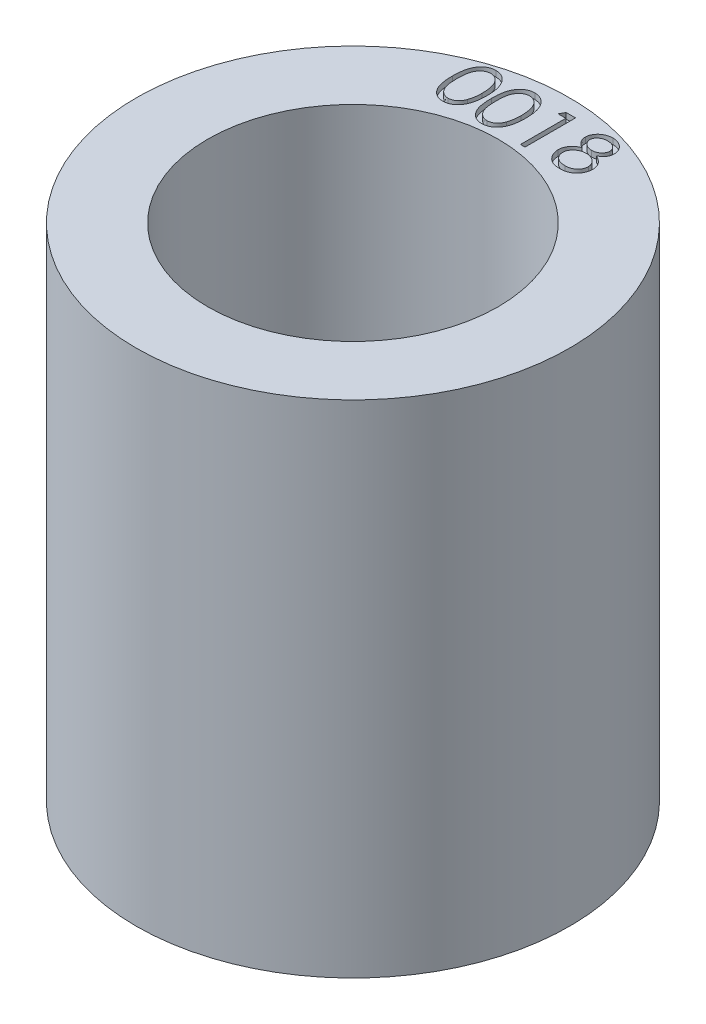
from build123d import *

# Parameters (mm, degrees)
SKETCH1_R           = 3.81
SKETCH1_R_2         = 2.5527
BOSS_EXTRUDE2_DEPTH = 8.8011
CUT_EXTRUDE1_DEPTH  = 0.1016


with BuildPart() as part:
    # Sketch1 → Boss-Extrude2 (new body)
    with BuildSketch(Plane(origin=(0, 0, 0), x_dir=(1, 0, 0), z_dir=(0, 1, 0))):
        with Locations(Location((0, 0, 0), (0, 0, 270))):
            Circle(SKETCH1_R)
        with Locations(Location((0, 0, 0), (0, 0, 270))):
            Circle(SKETCH1_R_2, mode=Mode.SUBTRACT)
    extrude(amount=BOSS_EXTRUDE2_DEPTH)

    # Sketch2 → Cut-Extrude1 (cut)
    # profile 1 of 4: a face of its own
    with BuildSketch(Plane(origin=(0, 8.8011, 0), x_dir=(1, 0, 0), z_dir=(0, 1, 0))):
        with BuildLine():
            add(Edge.make_bspline(
                [(-1.363580857, 3.11114383), (-1.363497541, 3.125392567), (-1.363335697, 3.153070943), (-1.361535238, 3.193402242), (-1.358544301, 3.231238155), (-1.354445408, 3.266580494), (-1.349457361, 3.299438382), (-1.342798628, 3.32972401), (-1.335226176, 3.35757755), (-1.326449855, 3.383089831), (-1.316546956, 3.406604567), (-1.305768654, 3.428556568), (-1.293687196, 3.448912619), (-1.28099306, 3.467997618), (-1.267172394, 3.485499157), (-1.252618501, 3.501664393), (-1.236763345, 3.516119723), (-1.220145901, 3.529288684), (-1.202615719, 3.54083285), (-1.184672481, 3.551001166), (-1.166192685, 3.559687932), (-1.147125874, 3.566518103), (-1.127643424, 3.572159658), (-1.107677229, 3.57601765), (-1.087194323, 3.578445105), (-1.073368739, 3.578677177), (-1.066357099, 3.578794872)],
                knots=[0, 0, 0, 0, 1.646270934, 3.197905019, 4.663502075, 6.030701355, 7.308322542, 8.50163776, 9.611534131, 10.641858119, 11.616356847, 12.558055219, 13.465016945, 14.349605745, 15.204443733, 16.039544428, 16.859896111, 17.680448484, 18.487036065, 19.28249412, 20.06191084, 20.843045899, 21.620316918, 22.403196591, 23.190181807, 24, 24, 24, 24], degree=3))
            add(Edge.make_bspline(
                [(-1.066357099, 3.578794872), (-1.059286888, 3.578670967), (-1.045226461, 3.578424559), (-1.024439006, 3.576056277), (-1.004131787, 3.572126612), (-0.98439138, 3.566558684), (-0.965055633, 3.559650982), (-0.946275786, 3.550992855), (-0.927935187, 3.540914422), (-0.910325294, 3.529071958), (-0.893252781, 3.515868459), (-0.877136999, 3.500942742), (-0.861976479, 3.484445513), (-0.847580951, 3.466553279), (-0.83435883, 3.446922868), (-0.821767178, 3.425895704), (-0.810496681, 3.403104064), (-0.799642073, 3.378928226), (-0.790272779, 3.352699256), (-0.781823152, 3.324565007), (-0.774995894, 3.294193164), (-0.769309019, 3.261743077), (-0.764903416, 3.227095576), (-0.761694725, 3.190324932), (-0.759999761, 3.151406953), (-0.759680559, 3.124798459), (-0.759516755, 3.11114383)],
                knots=[0, 0, 0, 0, 0.810914788, 1.612654377, 2.396697861, 3.181598691, 3.963628158, 4.749916497, 5.551656086, 6.361998678, 7.18212741, 8.025565596, 8.878627764, 9.750805457, 10.657531673, 11.591944965, 12.560506719, 13.57287815, 14.630710178, 15.753379473, 16.941251878, 18.199788006, 19.531962791, 20.947069417, 22.433333509, 24, 24, 24, 24], degree=3))
            add(Edge.make_bspline(
                [(-0.759516755, 3.11114383), (-0.759682257, 3.097548758), (-0.760004732, 3.071059313), (-0.761675723, 3.032316445), (-0.764967216, 2.995740942), (-0.769084553, 2.961245085), (-0.774787097, 2.92897245), (-0.78179881, 2.89881136), (-0.789583992, 2.870631565), (-0.799194029, 2.844663923), (-0.80971235, 2.820546186), (-0.82115637, 2.79802473), (-0.833416905, 2.776900492), (-0.846774447, 2.757342556), (-0.861012014, 2.739212377), (-0.876434332, 2.722829981), (-0.892606661, 2.70780063), (-0.909729414, 2.694427117), (-0.927613948, 2.682721576), (-0.945891554, 2.672253258), (-0.964886533, 2.663812154), (-0.984168423, 2.656564254), (-1.004013028, 2.651026939), (-1.024395611, 2.647198179), (-1.045212495, 2.64451293), (-1.059284493, 2.644308084), (-1.066357099, 2.644205128)],
                knots=[0, 0, 0, 0, 1.561518951, 3.042555995, 4.452378317, 5.7783523, 7.031515105, 8.214008947, 9.334062868, 10.386615937, 11.391082383, 12.354592575, 13.286541444, 14.194233754, 15.072674879, 15.931287219, 16.775624067, 17.606195743, 18.42308326, 19.229000347, 20.022332153, 20.807536673, 21.593273796, 22.3848459, 23.188221202, 24, 24, 24, 24], degree=3))
            add(Edge.make_bspline(
                [(-1.066357099, 2.644205128), (-1.073368544, 2.644323582), (-1.087193745, 2.644557151), (-1.107679461, 2.646973639), (-1.127563202, 2.650858697), (-1.146943085, 2.656298514), (-1.16591854, 2.662957083), (-1.184230997, 2.671632118), (-1.202084069, 2.681622972), (-1.219430124, 2.693001009), (-1.235943213, 2.706036716), (-1.251716258, 2.720454846), (-1.266353013, 2.736615192), (-1.279976074, 2.754262585), (-1.292923492, 2.773234668), (-1.304833393, 2.793790475), (-1.31584959, 2.815848498), (-1.325919036, 2.839551247), (-1.334846797, 2.865244599), (-1.342732915, 2.89322249), (-1.348959511, 2.923731862), (-1.354289181, 2.956527673), (-1.358587975, 2.991750852), (-1.361522773, 3.029420519), (-1.363336667, 3.069513202), (-1.363497975, 3.097013725), (-1.363580857, 3.11114383)],
                knots=[0, 0, 0, 0, 0.810891512, 1.598919785, 2.382837074, 3.152667961, 3.926044502, 4.706494248, 5.493654104, 6.291793342, 7.103789334, 7.925228297, 8.761435821, 9.622817696, 10.50288917, 11.416980706, 12.369136599, 13.353924996, 14.394355917, 15.514179734, 16.714354668, 17.994756427, 19.357759367, 20.818452758, 22.365282078, 24, 24, 24, 24], degree=3))
        make_face()
        with BuildLine():
            add(Edge.make_bspline(
                [(-1.283798806, 3.1115), (-1.283768466, 3.099625831), (-1.283709583, 3.076580399), (-1.282171308, 3.043092211), (-1.280075749, 3.011857747), (-1.27737286, 2.982837349), (-1.273358911, 2.956129246), (-1.268861387, 2.931549746), (-1.263388172, 2.909228928), (-1.256912438, 2.889013624), (-1.249536507, 2.870560761), (-1.241483218, 2.853390052), (-1.232831794, 2.83729866), (-1.22314953, 2.822431124), (-1.212604704, 2.808738958), (-1.201435496, 2.795979819), (-1.189225059, 2.784601385), (-1.172333109, 2.770954764), (-1.150032804, 2.756852904), (-1.121935209, 2.744572998), (-1.093063422, 2.736855854), (-1.073467005, 2.73587446), (-1.063685825, 2.735384615)],
                knots=[0, 0, 0, 0, 1.459021318, 2.831673884, 4.118529203, 5.306027144, 6.411944654, 7.436330062, 8.375795394, 9.233974572, 10.042671642, 10.816086306, 11.563610507, 12.285937304, 12.993564865, 13.685989202, 14.367179055, 15.041617293, 16.353048772, 17.594441528, 18.799311195, 20, 20, 20, 20], degree=3))
            add(Edge.make_bspline(
                [(-1.063685825, 2.735384615), (-1.053841377, 2.735790452), (-1.034172804, 2.736601286), (-1.00543682, 2.744424166), (-0.977539932, 2.756227429), (-0.955677659, 2.770184095), (-0.939045093, 2.783475491), (-0.927128177, 2.794807612), (-0.916190417, 2.807496402), (-0.90581653, 2.821186823), (-0.896301925, 2.836140434), (-0.887649888, 2.852285328), (-0.879754718, 2.869666339), (-0.87525662, 2.881799853), (-0.872956859, 2.888003405)],
                knots=[0, 0, 0, 0, 1.353760809, 2.704726607, 4.075137775, 5.516104923, 6.260822281, 7.007110065, 7.778089737, 8.566572457, 9.372053459, 10.217411131, 11.088608312, 12, 12, 12, 12], degree=3))
            add(Edge.make_bspline(
                [(-0.872956859, 2.888003405), (-0.87027671, 2.895935759), (-0.864834858, 2.912041839), (-0.857821467, 2.937026207), (-0.852298136, 2.963239709), (-0.847329041, 2.990525689), (-0.843937365, 3.019085373), (-0.84120742, 3.048830394), (-0.839599426, 3.07978318), (-0.839400099, 3.100813108), (-0.839298806, 3.1115)],
                knots=[0, 0, 0, 0, 0.884706709, 1.796334032, 2.740027952, 3.714592787, 4.726048262, 5.777819803, 6.87074269, 8, 8, 8, 8], degree=3))
            add(Edge.make_bspline(
                [(-0.839298806, 3.1115), (-0.839438554, 3.122185163), (-0.839711931, 3.143087627), (-0.840756884, 3.173699245), (-0.843455272, 3.202774056), (-0.846452248, 3.230437316), (-0.850871142, 3.256535893), (-0.855635625, 3.281288271), (-0.862036733, 3.304387799), (-0.868874356, 3.326196133), (-0.876700196, 3.346465499), (-0.885314793, 3.365290401), (-0.89451512, 3.382761721), (-0.904508049, 3.398831524), (-0.915174952, 3.41357179), (-0.92679737, 3.426686977), (-0.93891428, 3.438583567), (-0.955885846, 3.45216306), (-0.978104315, 3.46600903), (-1.00575111, 3.478751133), (-1.034521853, 3.48606844), (-1.053971511, 3.487100108), (-1.063685825, 3.487615385)],
                knots=[0, 0, 0, 0, 1.31362396, 2.569729283, 3.763502607, 4.902122613, 5.988968491, 7.01645872, 7.998833611, 8.933434873, 9.825090667, 10.667526885, 11.477055099, 12.250526234, 12.991942729, 13.710640831, 14.402115721, 15.076753259, 16.378508321, 17.609869233, 18.806226677, 20, 20, 20, 20], degree=3))
            add(Edge.make_bspline(
                [(-1.063685825, 3.487615385), (-1.073518315, 3.487099397), (-1.093201209, 3.486066482), (-1.122270989, 3.478778396), (-1.150135895, 3.466075103), (-1.17229561, 3.4521172), (-1.189279012, 3.438823269), (-1.201238016, 3.427295109), (-1.212451144, 3.414684961), (-1.22278074, 3.400866874), (-1.232455418, 3.386016671), (-1.241340595, 3.370017525), (-1.249345996, 3.352788358), (-1.256733469, 3.334343784), (-1.263228957, 3.314130224), (-1.268586823, 3.2918369), (-1.273536535, 3.267335579), (-1.277040533, 3.240482824), (-1.280155527, 3.211455157), (-1.28215739, 3.180142718), (-1.283714729, 3.146598366), (-1.283770219, 3.123433779), (-1.283798806, 3.1115)],
                knots=[0, 0, 0, 0, 1.207732386, 2.417664972, 3.655092373, 4.956220595, 5.625982001, 6.301752483, 6.994047911, 7.697131622, 8.419323945, 9.170223765, 9.943494443, 10.752040957, 11.610060368, 12.549350801, 13.567764191, 14.679664412, 15.874934091, 17.154273443, 18.533957287, 20, 20, 20, 20], degree=3))
        make_face(mode=Mode.SUBTRACT)
    # profile 2 of 4: a face of its own
    with BuildSketch(Plane(origin=(0, 8.8011, 0), x_dir=(1, 0, 0), z_dir=(0, 1, 0))):
        with BuildLine():
            add(Edge.make_bspline(
                [(-0.679734703, 3.11114383), (-0.679651387, 3.125392567), (-0.679489543, 3.153070943), (-0.677689084, 3.193402242), (-0.674698147, 3.231238155), (-0.670599254, 3.266580494), (-0.665611207, 3.299438382), (-0.658952474, 3.32972401), (-0.651380022, 3.35757755), (-0.642603701, 3.383089831), (-0.632700802, 3.406604567), (-0.6219225, 3.428556568), (-0.609841042, 3.448912619), (-0.597146906, 3.467997618), (-0.58332624, 3.485499157), (-0.568772347, 3.501664393), (-0.552917191, 3.516119723), (-0.536299747, 3.529288684), (-0.518769565, 3.54083285), (-0.500826328, 3.551001166), (-0.482346531, 3.559687932), (-0.46327972, 3.566518103), (-0.443797271, 3.572159658), (-0.423831076, 3.57601765), (-0.403348169, 3.578445105), (-0.389522585, 3.578677177), (-0.382510945, 3.578794872)],
                knots=[0, 0, 0, 0, 1.646270934, 3.197905019, 4.663502075, 6.030701355, 7.308322542, 8.50163776, 9.611534131, 10.641858119, 11.616356847, 12.558055219, 13.465016945, 14.349605745, 15.204443733, 16.039544428, 16.859896111, 17.680448484, 18.487036065, 19.28249412, 20.06191084, 20.843045899, 21.620316918, 22.403196591, 23.190181807, 24, 24, 24, 24], degree=3))
            add(Edge.make_bspline(
                [(-0.382510945, 3.578794872), (-0.375440734, 3.578670967), (-0.361380308, 3.578424559), (-0.340592852, 3.576056277), (-0.320285633, 3.572126612), (-0.300545226, 3.566558684), (-0.281209479, 3.559650982), (-0.262429632, 3.550992855), (-0.244089033, 3.540914422), (-0.22647914, 3.529071958), (-0.209406628, 3.515868459), (-0.193290845, 3.500942742), (-0.178130325, 3.484445513), (-0.163734798, 3.466553279), (-0.150512676, 3.446922868), (-0.137921024, 3.425895704), (-0.126650527, 3.403104064), (-0.11579592, 3.378928226), (-0.106426625, 3.352699256), (-0.097976999, 3.324565007), (-0.091149741, 3.294193164), (-0.085462865, 3.261743077), (-0.081057262, 3.227095576), (-0.077848571, 3.190324932), (-0.076153607, 3.151406953), (-0.075834405, 3.124798459), (-0.075670601, 3.11114383)],
                knots=[0, 0, 0, 0, 0.810914788, 1.612654377, 2.396697861, 3.181598691, 3.963628158, 4.749916497, 5.551656086, 6.361998678, 7.18212741, 8.025565596, 8.878627764, 9.750805457, 10.657531673, 11.591944965, 12.560506719, 13.57287815, 14.630710178, 15.753379473, 16.941251878, 18.199788006, 19.531962791, 20.947069417, 22.433333509, 24, 24, 24, 24], degree=3))
            add(Edge.make_bspline(
                [(-0.075670601, 3.11114383), (-0.075836103, 3.097548758), (-0.076158578, 3.071059313), (-0.07782957, 3.032316445), (-0.081121062, 2.995740942), (-0.085238399, 2.961245085), (-0.090940944, 2.92897245), (-0.097952656, 2.89881136), (-0.105737838, 2.870631565), (-0.115347875, 2.844663923), (-0.125866196, 2.820546186), (-0.137310216, 2.79802473), (-0.149570752, 2.776900492), (-0.162928293, 2.757342556), (-0.17716586, 2.739212377), (-0.192588178, 2.722829981), (-0.208760507, 2.70780063), (-0.22588326, 2.694427117), (-0.243767794, 2.682721576), (-0.2620454, 2.672253258), (-0.281040379, 2.663812154), (-0.300322269, 2.656564254), (-0.320166874, 2.651026939), (-0.340549457, 2.647198179), (-0.361366341, 2.64451293), (-0.375438339, 2.644308084), (-0.382510945, 2.644205128)],
                knots=[0, 0, 0, 0, 1.561518951, 3.042555995, 4.452378317, 5.7783523, 7.031515105, 8.214008947, 9.334062868, 10.386615937, 11.391082383, 12.354592575, 13.286541444, 14.194233754, 15.072674879, 15.931287219, 16.775624067, 17.606195743, 18.42308326, 19.229000347, 20.022332153, 20.807536673, 21.593273796, 22.3848459, 23.188221202, 24, 24, 24, 24], degree=3))
            add(Edge.make_bspline(
                [(-0.382510945, 2.644205128), (-0.38952239, 2.644323582), (-0.403347591, 2.644557151), (-0.423833307, 2.646973639), (-0.443717048, 2.650858697), (-0.463096931, 2.656298514), (-0.482072386, 2.662957083), (-0.500384843, 2.671632118), (-0.518237915, 2.681622972), (-0.53558397, 2.693001009), (-0.552097059, 2.706036716), (-0.567870105, 2.720454846), (-0.582506859, 2.736615192), (-0.59612992, 2.754262585), (-0.609077338, 2.773234668), (-0.620987239, 2.793790475), (-0.632003436, 2.815848498), (-0.642072882, 2.839551247), (-0.651000643, 2.865244599), (-0.658886761, 2.89322249), (-0.665113357, 2.923731862), (-0.670443028, 2.956527673), (-0.674741821, 2.991750852), (-0.677676619, 3.029420519), (-0.679490513, 3.069513202), (-0.679651821, 3.097013725), (-0.679734703, 3.11114383)],
                knots=[0, 0, 0, 0, 0.810891512, 1.598919785, 2.382837074, 3.152667961, 3.926044502, 4.706494248, 5.493654104, 6.291793342, 7.103789334, 7.925228297, 8.761435821, 9.622817696, 10.50288917, 11.416980706, 12.369136599, 13.353924996, 14.394355917, 15.514179734, 16.714354668, 17.994756427, 19.357759367, 20.818452758, 22.365282078, 24, 24, 24, 24], degree=3))
        make_face()
        with BuildLine():
            add(Edge.make_bspline(
                [(-0.599952652, 3.1115), (-0.599922312, 3.099625831), (-0.599863429, 3.076580399), (-0.598325154, 3.043092211), (-0.596229595, 3.011857747), (-0.593526706, 2.982837349), (-0.589512757, 2.956129246), (-0.585015233, 2.931549746), (-0.579542018, 2.909228928), (-0.573066284, 2.889013624), (-0.565690353, 2.870560761), (-0.557637064, 2.853390052), (-0.54898564, 2.83729866), (-0.539303376, 2.822431124), (-0.52875855, 2.808738958), (-0.517589342, 2.795979819), (-0.505378906, 2.784601385), (-0.488486955, 2.770954764), (-0.46618665, 2.756852904), (-0.438089055, 2.744572998), (-0.409217268, 2.736855854), (-0.389620851, 2.73587446), (-0.379839671, 2.735384615)],
                knots=[0, 0, 0, 0, 1.459021318, 2.831673884, 4.118529203, 5.306027144, 6.411944654, 7.436330062, 8.375795394, 9.233974572, 10.042671642, 10.816086306, 11.563610507, 12.285937304, 12.993564865, 13.685989202, 14.367179055, 15.041617293, 16.353048772, 17.594441528, 18.799311195, 20, 20, 20, 20], degree=3))
            add(Edge.make_bspline(
                [(-0.379839671, 2.735384615), (-0.369995223, 2.735790452), (-0.350326651, 2.736601286), (-0.321590667, 2.744424166), (-0.293693778, 2.756227429), (-0.271831505, 2.770184095), (-0.255198939, 2.783475491), (-0.243282024, 2.794807612), (-0.232344263, 2.807496402), (-0.221970376, 2.821186823), (-0.212455771, 2.836140434), (-0.203803734, 2.852285328), (-0.195908564, 2.869666339), (-0.191410466, 2.881799853), (-0.189110705, 2.888003405)],
                knots=[0, 0, 0, 0, 1.353760809, 2.704726607, 4.075137775, 5.516104923, 6.260822281, 7.007110065, 7.778089737, 8.566572457, 9.372053459, 10.217411131, 11.088608312, 12, 12, 12, 12], degree=3))
            add(Edge.make_bspline(
                [(-0.189110705, 2.888003405), (-0.186430556, 2.895935759), (-0.180988704, 2.912041839), (-0.173975313, 2.937026207), (-0.168451982, 2.963239709), (-0.163482887, 2.990525689), (-0.160091211, 3.019085373), (-0.157361266, 3.048830394), (-0.155753272, 3.07978318), (-0.155553945, 3.100813108), (-0.155452652, 3.1115)],
                knots=[0, 0, 0, 0, 0.884706709, 1.796334032, 2.740027952, 3.714592787, 4.726048262, 5.777819803, 6.87074269, 8, 8, 8, 8], degree=3))
            add(Edge.make_bspline(
                [(-0.155452652, 3.1115), (-0.1555924, 3.122185163), (-0.155865777, 3.143087627), (-0.15691073, 3.173699245), (-0.159609118, 3.202774056), (-0.162606094, 3.230437316), (-0.167024988, 3.256535893), (-0.171789471, 3.281288271), (-0.178190579, 3.304387799), (-0.185028202, 3.326196133), (-0.192854043, 3.346465499), (-0.201468639, 3.365290401), (-0.210668966, 3.382761721), (-0.220661895, 3.398831524), (-0.231328798, 3.41357179), (-0.242951216, 3.426686977), (-0.255068126, 3.438583567), (-0.272039692, 3.45216306), (-0.294258161, 3.46600903), (-0.321904956, 3.478751133), (-0.350675699, 3.48606844), (-0.370125357, 3.487100108), (-0.379839671, 3.487615385)],
                knots=[0, 0, 0, 0, 1.31362396, 2.569729283, 3.763502607, 4.902122613, 5.988968491, 7.01645872, 7.998833611, 8.933434873, 9.825090667, 10.667526885, 11.477055099, 12.250526234, 12.991942729, 13.710640831, 14.402115721, 15.076753259, 16.378508321, 17.609869233, 18.806226677, 20, 20, 20, 20], degree=3))
            add(Edge.make_bspline(
                [(-0.379839671, 3.487615385), (-0.389672162, 3.487099397), (-0.409355055, 3.486066482), (-0.438424835, 3.478778396), (-0.466289741, 3.466075103), (-0.488449456, 3.4521172), (-0.505432858, 3.438823269), (-0.517391862, 3.427295109), (-0.52860499, 3.414684961), (-0.538934586, 3.400866874), (-0.548609264, 3.386016671), (-0.557494441, 3.370017525), (-0.565499843, 3.352788358), (-0.572887315, 3.334343784), (-0.579382803, 3.314130224), (-0.58474067, 3.2918369), (-0.589690381, 3.267335579), (-0.593194379, 3.240482824), (-0.596309373, 3.211455157), (-0.598311236, 3.180142718), (-0.599868575, 3.146598366), (-0.599924065, 3.123433779), (-0.599952652, 3.1115)],
                knots=[0, 0, 0, 0, 1.207732386, 2.417664972, 3.655092373, 4.956220595, 5.625982001, 6.301752483, 6.994047911, 7.697131622, 8.419323945, 9.170223765, 9.943494443, 10.752040957, 11.610060368, 12.549350801, 13.567764191, 14.679664412, 15.874934091, 17.154273443, 18.533957287, 20, 20, 20, 20], degree=3))
        make_face(mode=Mode.SUBTRACT)
    # profile 3 of 4: a face of its own
    with BuildSketch(Plane(origin=(0, 8.8011, 0), x_dir=(1, 0, 0), z_dir=(0, 1, 0))):
        Polygon((0.193059568, 3.556), (0.357431963, 3.556), (0.357431963, 2.667), (0.277649912, 2.667), (0.277649912, 3.464820513), (0.140880681, 3.464820513), align=None)
    # profile 4 of 4: a face of its own
    with BuildSketch(Plane(origin=(0, 8.8011, 0), x_dir=(1, 0, 0), z_dir=(0, 1, 0))):
        with BuildLine():
            add(Edge.make_bspline(
                [(1.120169744, 3.162254207), (1.127446475, 3.158459966), (1.14163853, 3.151059929), (1.161851141, 3.139144579), (1.180323292, 3.126586574), (1.197567494, 3.113979066), (1.213280785, 3.100839226), (1.227287466, 3.087114804), (1.239933522, 3.073148374), (1.250963925, 3.058703435), (1.260665921, 3.043818362), (1.269051004, 3.028454087), (1.276218173, 3.01264428), (1.28189836, 2.996216365), (1.286577495, 2.979411659), (1.289797098, 2.962013171), (1.291528596, 2.944135549), (1.291855954, 2.9320532), (1.292021707, 2.925935497)],
                knots=[0, 0, 0, 0, 1.272397273, 2.481599622, 3.635517121, 4.734568067, 5.792894095, 6.808321871, 7.773003508, 8.711915296, 9.623354172, 10.525449501, 11.423591555, 12.311487226, 13.218079475, 14.126165749, 15.051214107, 16, 16, 16, 16], degree=3))
            add(Edge.make_bspline(
                [(1.292021707, 2.925935497), (1.291825766, 2.917376273), (1.291437926, 2.900434357), (1.28805973, 2.875429044), (1.283001833, 2.851143652), (1.275615637, 2.827583503), (1.266036436, 2.804878602), (1.25423132, 2.783009514), (1.240868073, 2.761617809), (1.230136005, 2.748455681), (1.224705601, 2.741795673)],
                knots=[0, 0, 0, 0, 1.025265484, 2.029385089, 3.018602448, 3.995076438, 4.983346944, 5.966715145, 6.97116228, 8, 8, 8, 8], degree=3))
            add(Edge.make_bspline(
                [(1.224705601, 2.741795673), (1.217635137, 2.734024854), (1.203581579, 2.718579243), (1.179506716, 2.698525738), (1.153085157, 2.681672991), (1.124419141, 2.66793873), (1.093585293, 2.657248922), (1.060590184, 2.649567323), (1.025369489, 2.645167426), (1.001161899, 2.644531412), (0.988743061, 2.644205128)],
                knots=[0, 0, 0, 0, 0.954267603, 1.896743057, 2.838368354, 3.796610408, 4.779680527, 5.799409237, 6.871065594, 8, 8, 8, 8], degree=3))
            add(Edge.make_bspline(
                [(0.988743061, 2.644205128), (0.97680166, 2.644497858), (0.953564908, 2.645067479), (0.919742807, 2.648926865), (0.888215547, 2.655690343), (0.858799815, 2.664947274), (0.831672947, 2.676989472), (0.806912239, 2.691977608), (0.78416045, 2.709308394), (0.764108046, 2.72947957), (0.746305581, 2.751084269), (0.730667296, 2.773373178), (0.71766908, 2.796348331), (0.706663998, 2.819667148), (0.69823932, 2.843656471), (0.692404378, 2.868192875), (0.688698693, 2.893233501), (0.688205644, 2.910132541), (0.687957604, 2.918634014)],
                knots=[0, 0, 0, 0, 1.256902934, 2.445805442, 3.576955095, 4.645999104, 5.686449165, 6.692658513, 7.68621702, 8.689161843, 9.678783111, 10.630372946, 11.551080876, 12.453998257, 13.34127905, 14.221779781, 15.105423033, 16, 16, 16, 16], degree=3))
            add(Edge.make_bspline(
                [(0.687957604, 2.918634014), (0.688104386, 2.924872049), (0.688394479, 2.937200608), (0.69040231, 2.955414777), (0.693630259, 2.973142995), (0.698014161, 2.990450744), (0.703955482, 3.007212019), (0.711128984, 3.02350624), (0.7194937, 3.039351801), (0.729166316, 3.054835357), (0.74041903, 3.069739953), (0.753160597, 3.084318535), (0.767645676, 3.09834489), (0.783713121, 3.111990386), (0.801179314, 3.125497083), (0.820497927, 3.138135038), (0.841156831, 3.150798961), (0.855839404, 3.158370276), (0.863371266, 3.162254207)],
                knots=[0, 0, 0, 0, 0.941657376, 1.861047343, 2.762797495, 3.66048619, 4.553285746, 5.444104102, 6.34607688, 7.256116206, 8.197091036, 9.162375105, 10.176350973, 11.237807142, 12.343728897, 13.50695164, 14.721116704, 16, 16, 16, 16], degree=3))
            add(Edge.make_bspline(
                [(0.863371266, 3.162254207), (0.853061057, 3.167876438), (0.833097606, 3.178762651), (0.806663968, 3.19876434), (0.78395875, 3.220427445), (0.765606052, 3.244209413), (0.751160506, 3.269367319), (0.74124978, 3.295743759), (0.734545073, 3.322849652), (0.733880907, 3.341367826), (0.733547348, 3.350668069)],
                knots=[0, 0, 0, 0, 1.166880483, 2.259407225, 3.286803203, 4.280235371, 5.237608625, 6.161067461, 7.076446754, 8, 8, 8, 8], degree=3))
            add(Edge.make_bspline(
                [(0.733547348, 3.350668069), (0.733962746, 3.360141649), (0.734797768, 3.379185196), (0.741549931, 3.407533152), (0.752553228, 3.435375759), (0.767519161, 3.46257807), (0.786159514, 3.488219425), (0.808523337, 3.511216825), (0.834076574, 3.531361942), (0.862691672, 3.54827229), (0.893485676, 3.562034939), (0.92597627, 3.571529058), (0.959597359, 3.577735832), (0.98248218, 3.578438562), (0.994085609, 3.578794872)],
                knots=[0, 0, 0, 0, 0.888701115, 1.786444228, 2.72001202, 3.692817113, 4.693886446, 5.687152267, 6.695133018, 7.739871481, 8.800368666, 9.853104506, 10.91144658, 12, 12, 12, 12], degree=3))
            add(Edge.make_bspline(
                [(0.994085609, 3.578794872), (1.005389578, 3.578427501), (1.027679717, 3.577703087), (1.060444353, 3.57166122), (1.091794272, 3.561569922), (1.121621364, 3.547880027), (1.149391659, 3.531017744), (1.173928645, 3.510595922), (1.195603121, 3.487699968), (1.213531557, 3.462066389), (1.228304931, 3.434968604), (1.23859216, 3.406616483), (1.245183961, 3.377622622), (1.246015396, 3.358004169), (1.246431963, 3.34817488)],
                knots=[0, 0, 0, 0, 1.072916533, 2.115669174, 3.151510826, 4.193348718, 5.225979165, 6.227137561, 7.216255879, 8.211077061, 9.189680878, 10.138522389, 11.067357538, 12, 12, 12, 12], degree=3))
            add(Edge.make_bspline(
                [(1.246431963, 3.34817488), (1.246067585, 3.338528807), (1.245351966, 3.319584469), (1.239332182, 3.291967933), (1.2291942, 3.266105135), (1.215352683, 3.241702605), (1.197312209, 3.219202904), (1.175313591, 3.198319921), (1.149532215, 3.178882107), (1.13016195, 3.16791277), (1.120169744, 3.162254207)],
                knots=[0, 0, 0, 0, 0.975232327, 1.915300861, 2.843280834, 3.77672583, 4.742871857, 5.749627742, 6.839139064, 8, 8, 8, 8], degree=3))
        make_face()
        with BuildLine():
            add(Edge.make_bspline(
                [(0.989633486, 3.487615385), (0.983397581, 3.487449919), (0.971197425, 3.487126195), (0.953308542, 3.485434901), (0.936297561, 3.482144784), (0.919986748, 3.477766151), (0.904599729, 3.471851002), (0.889927533, 3.46489267), (0.876219866, 3.456432929), (0.863311255, 3.446943185), (0.851690559, 3.436505587), (0.841377003, 3.425630903), (0.832810062, 3.414105553), (0.82553522, 3.40221623), (0.820256714, 3.389610063), (0.816303381, 3.376673544), (0.813630948, 3.363243197), (0.813430697, 3.354064523), (0.813329399, 3.349421474)],
                knots=[0, 0, 0, 0, 1.203892937, 2.355340988, 3.463153438, 4.544400666, 5.610487187, 6.640501085, 7.674077295, 8.714426146, 9.728707835, 10.68524104, 11.601827946, 12.495867327, 13.368432065, 14.231010473, 15.105153427, 16, 16, 16, 16], degree=3))
            add(Edge.make_bspline(
                [(0.813329399, 3.349421474), (0.81350399, 3.344778225), (0.813849008, 3.335602497), (0.81651731, 3.322052647), (0.820494151, 3.308737551), (0.826755419, 3.29597382), (0.834265274, 3.283318687), (0.843534109, 3.271088438), (0.854580322, 3.25924051), (0.867033292, 3.247875676), (0.880599823, 3.23723339), (0.89497217, 3.227994602), (0.909969953, 3.220264338), (0.925439079, 3.213830669), (0.941537204, 3.208829425), (0.958165689, 3.205281389), (0.975327326, 3.203076162), (0.986955594, 3.202812758), (0.992839015, 3.202679487)],
                knots=[0, 0, 0, 0, 0.873023192, 1.725219244, 2.590779336, 3.480155217, 4.391973325, 5.357036234, 6.360879153, 7.436073238, 8.526419356, 9.601555421, 10.645666583, 11.697338044, 12.750135903, 13.812665442, 14.89329948, 16, 16, 16, 16], degree=3))
            add(Edge.make_bspline(
                [(0.992839015, 3.202679487), (1.000395541, 3.202901195), (1.015433958, 3.203342422), (1.037602909, 3.20744482), (1.05915802, 3.213897923), (1.079868902, 3.222726955), (1.099199467, 3.233808431), (1.116430844, 3.247075618), (1.131416055, 3.26222217), (1.14399937, 3.279012291), (1.153755471, 3.296881594), (1.16135053, 3.314814069), (1.165785679, 3.333001035), (1.166364181, 3.345184644), (1.166649912, 3.351202324)],
                knots=[0, 0, 0, 0, 1.076279235, 2.141928126, 3.20205304, 4.278698113, 5.344010996, 6.36967002, 7.368914609, 8.37248503, 9.349703398, 10.264243087, 11.142681841, 12, 12, 12, 12], degree=3))
            add(Edge.make_bspline(
                [(1.166649912, 3.351202324), (1.16651481, 3.355425845), (1.166246652, 3.363808929), (1.164036838, 3.376188474), (1.160385376, 3.388286388), (1.155441754, 3.400202613), (1.148936866, 3.411769959), (1.141224362, 3.423170263), (1.131855699, 3.434147067), (1.121341005, 3.444956176), (1.109416871, 3.454959718), (1.096106277, 3.463756935), (1.081477465, 3.471227673), (1.065530088, 3.477295417), (1.048322877, 3.481852774), (1.029935087, 3.485265606), (1.010213397, 3.487189176), (0.99664224, 3.487470234), (0.989633486, 3.487615385)],
                knots=[0, 0, 0, 0, 0.814439003, 1.616544685, 2.417341072, 3.248991801, 4.09997495, 4.973547432, 5.9003056, 6.880240646, 7.880314356, 8.896779544, 9.951930927, 11.043077905, 12.18215768, 13.381699519, 14.647792085, 16, 16, 16, 16], degree=3))
        make_face(mode=Mode.SUBTRACT)
        with BuildLine():
            add(Edge.make_bspline(
                [(0.994797949, 3.1115), (0.986891999, 3.111359375), (0.971382456, 3.111083503), (0.948660396, 3.10801277), (0.926853692, 3.103738104), (0.906035868, 3.097253271), (0.886215715, 3.088821363), (0.867285938, 3.07867799), (0.849391351, 3.066687807), (0.832779058, 3.053003147), (0.817609333, 3.038256046), (0.804300165, 3.022644663), (0.792997794, 3.00645914), (0.783896149, 2.989493914), (0.776425569, 2.97210822), (0.771519844, 2.953869091), (0.768374889, 2.935127165), (0.767952581, 2.9223865), (0.767739656, 2.91596274)],
                knots=[0, 0, 0, 0, 1.140299081, 2.23698856, 3.303958914, 4.344563908, 5.37730929, 6.408454204, 7.439741482, 8.480804886, 9.510774543, 10.48932336, 11.43758569, 12.353841022, 13.263987381, 14.161954604, 15.073269652, 16, 16, 16, 16], degree=3))
            add(Edge.make_bspline(
                [(0.767739656, 2.91596274), (0.768085923, 2.90797929), (0.76877291, 2.892140312), (0.774222897, 2.868730892), (0.782969523, 2.846068744), (0.795167928, 2.824338548), (0.810272691, 2.804031221), (0.828846814, 2.786330272), (0.849735987, 2.770602216), (0.873647002, 2.757881761), (0.899765432, 2.747723067), (0.928084331, 2.740723853), (0.95819728, 2.736090525), (0.978989617, 2.735623627), (0.989633486, 2.735384615)],
                knots=[0, 0, 0, 0, 0.898778495, 1.783155532, 2.693654817, 3.627872908, 4.583023416, 5.533784346, 6.509005473, 7.520592997, 8.575161974, 9.658835044, 10.801527049, 12, 12, 12, 12], degree=3))
            add(Edge.make_bspline(
                [(0.989633486, 2.735384615), (0.997952079, 2.735544333), (1.014159367, 2.735855513), (1.037803198, 2.738602344), (1.060115713, 2.742958349), (1.081053644, 2.749294009), (1.100851379, 2.757028303), (1.119173251, 2.766978012), (1.136490597, 2.778294302), (1.151950084, 2.791720274), (1.166030119, 2.806066066), (1.178306776, 2.821252737), (1.188963994, 2.836867547), (1.197328456, 2.85326337), (1.204015325, 2.870125647), (1.208821908, 2.887609866), (1.211787666, 2.905769656), (1.212087614, 2.91808842), (1.212239656, 2.924332732)],
                knots=[0, 0, 0, 0, 1.224942928, 2.386581632, 3.501229538, 4.569074225, 5.605009692, 6.626002462, 7.634866581, 8.645888296, 9.63523824, 10.59253846, 11.518950513, 12.414518923, 13.29783783, 14.186679152, 15.080837789, 16, 16, 16, 16], degree=3))
            add(Edge.make_bspline(
                [(1.212239656, 2.924332732), (1.21200957, 2.930397577), (1.211555882, 2.942356391), (1.208676362, 2.960077089), (1.203617729, 2.977197403), (1.19667657, 2.993923305), (1.187435806, 3.009915894), (1.176553209, 3.025591802), (1.163422903, 3.040515939), (1.148586103, 3.054804225), (1.132416727, 3.068016222), (1.115229273, 3.07970389), (1.097156039, 3.089546927), (1.078235272, 3.097552117), (1.058508982, 3.103848134), (1.037991681, 3.108246397), (1.016659345, 3.111014896), (1.002167408, 3.111336472), (0.994797949, 3.1115)],
                knots=[0, 0, 0, 0, 0.917430815, 1.809013306, 2.70690318, 3.612392954, 4.541220862, 5.495268465, 6.494511384, 7.542276156, 8.608045339, 9.649016899, 10.681629292, 11.715607085, 12.752076957, 13.808767841, 14.885711793, 16, 16, 16, 16], degree=3))
        make_face(mode=Mode.SUBTRACT)
    extrude(amount=-CUT_EXTRUDE1_DEPTH, mode=Mode.SUBTRACT)


solid = part.part
